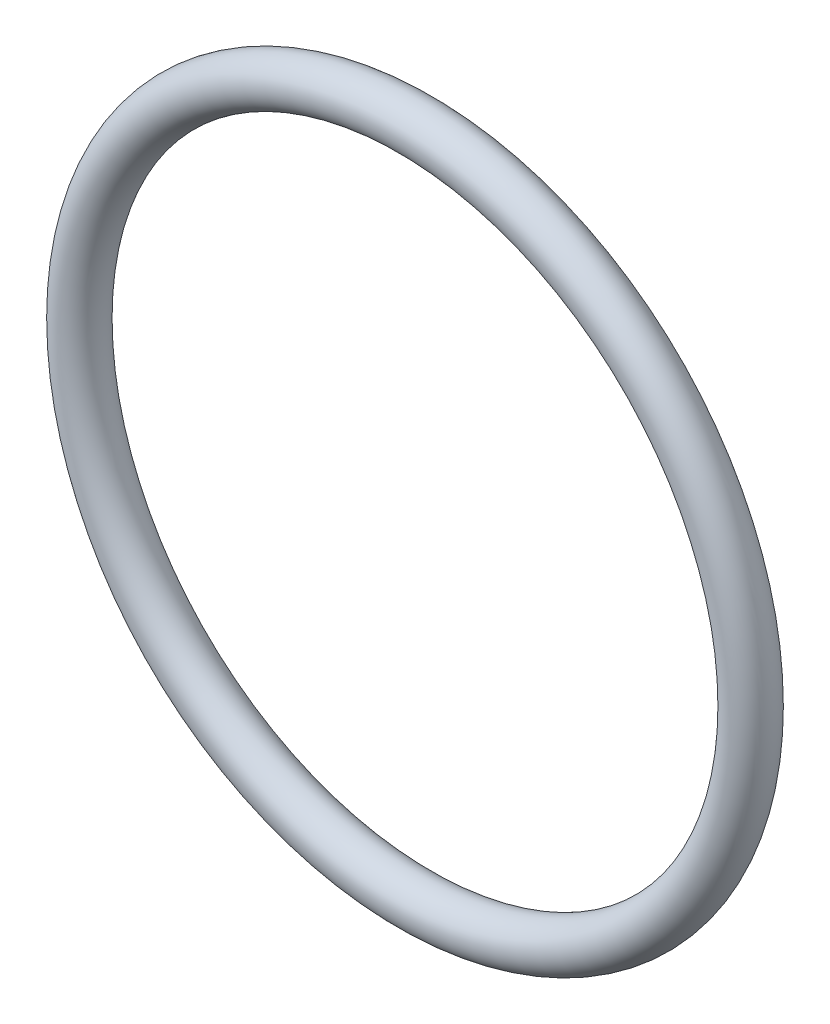
from build123d import *

# Parameters (mm, degrees)
SKETCH4_R = 2


with BuildPart() as part:
    # Sweep1: sweep along a path in Sketch3
    with BuildLine(Plane.XY) as sweep1_path:
        CenterArc((0, 0), 29, 0, 360)
    # Sketch4 → Sweep1 (sweep)
    with BuildSketch(Plane(origin=(0, 0, 0), x_dir=(1, 0, 0), z_dir=(0, 1, 0))):
        with Locations((-29, 0)):
            Circle(SKETCH4_R)
    sweep(path=sweep1_path.line)


solid = part.part
